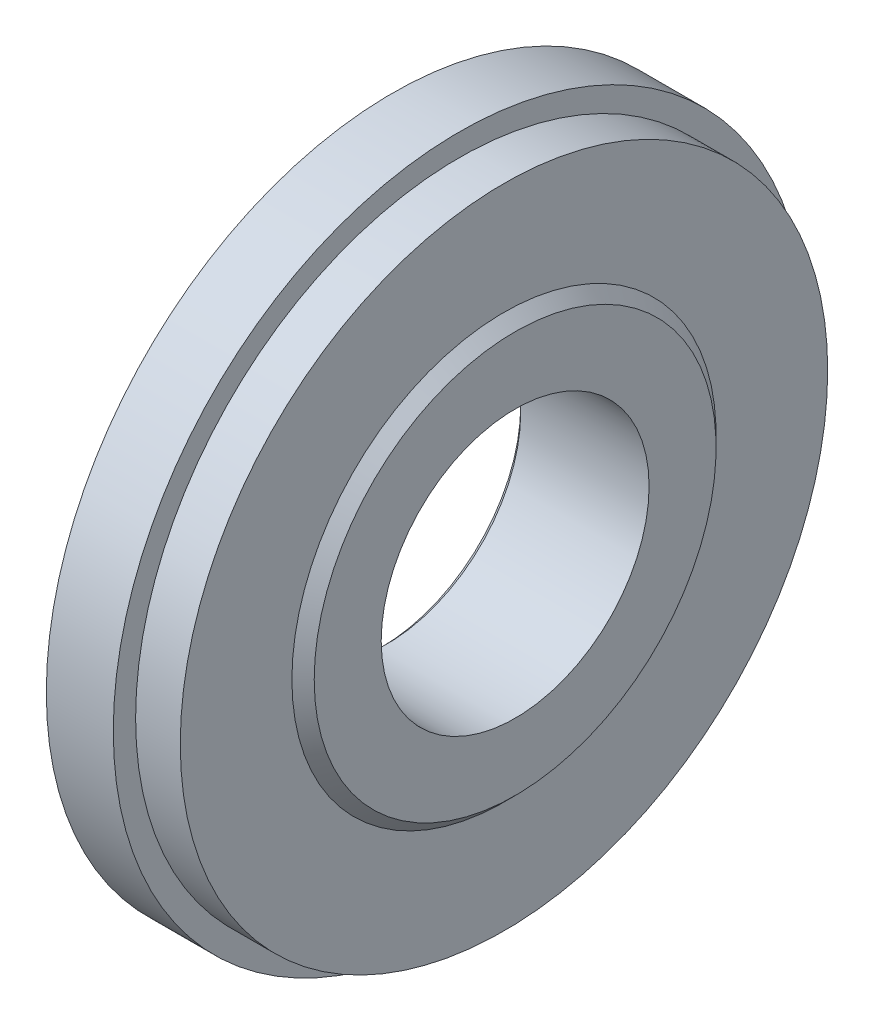
from build123d import *

# Parameters (mm, degrees)
CHANFREIN1_SIZE = 0.5


with BuildPart() as part:
    # Esquisse1 → Base-Révolution (revolve)
    with BuildSketch(Plane.XY, mode=Mode.PRIVATE) as base_r_volution_sk:
        with BuildLine():
            Line((0, 12), (0, 16))
            Line((0, 16), (5, 16))
            ThreePointArc((5, 16), (6.414213562, 16.585786438), (7, 18))
            Line((7, 18), (7, 26))
            ThreePointArc((7, 26), (6.414213562, 27.414213562), (5, 28))
            Line((5, 28), (1, 28))
            Line((1, 28), (1, 31))
            Line((1, 31), (7, 31))
            Line((7, 31), (7, 29))
            Line((7, 29), (11, 29))
            Line((11, 29), (11, 19))
            Line((11, 19), (12, 18))
            Line((12, 18), (12, 12))
            Line((12, 12), (0, 12))
        make_face()
    revolve(base_r_volution_sk.sketch.rotate(Axis((-8, 0, 0), (1, 0, 0)), 90), axis=Axis((-8, 0, 0), (1, 0, 0)))

    # Chanfrein1
    chanfrein1_edges = [part.edges().sort_by_distance(p)[0] for p in [
        (0, 0, -12),
        (0, 0, -16),
    ]]
    chamfer(chanfrein1_edges, length=CHANFREIN1_SIZE)


solid = part.part
